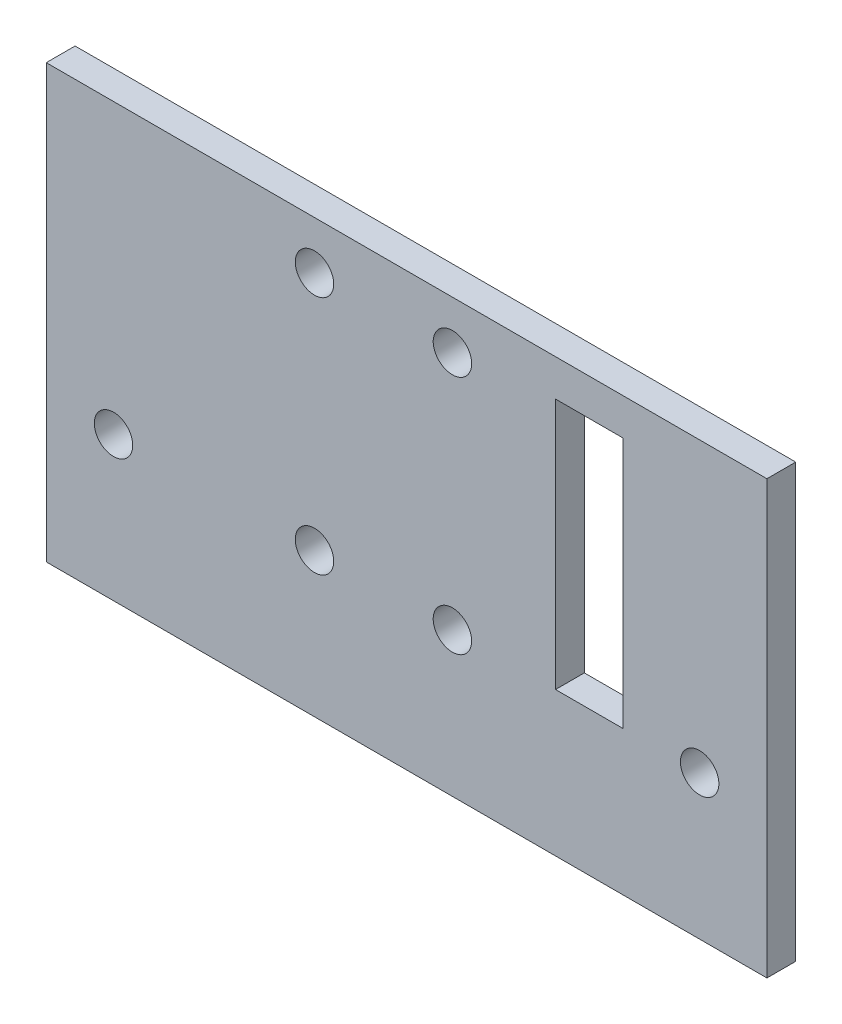
from build123d import *

# Parameters (mm, degrees)
SKETCH1_W           = 75
SKETCH1_H           = 40
SKETCH1_R           = 2
SKETCH1_W_2         = 7
SKETCH1_H_2         = 26.182038529
BOSS_EXTRUDE1_DEPTH = 3
SKETCH2_W           = 75
SKETCH2_H           = 5
BOSS_EXTRUDE2_DEPTH = 3


with BuildPart() as part:
    # Sketch1 → Boss-Extrude1 (new body)
    with BuildSketch(Plane.XY):
        Rectangle(SKETCH1_W, SKETCH1_H)
        with Locations((-30.5, -10)):
            Circle(SKETCH1_R, mode=Mode.SUBTRACT)
        with Locations((30.5, -10)):
            Circle(SKETCH1_R, mode=Mode.SUBTRACT)
        with Locations((4.771003885, 15)):
            Circle(SKETCH1_R, mode=Mode.SUBTRACT)
        with Locations((4.771003885, -10)):
            Circle(SKETCH1_R, mode=Mode.SUBTRACT)
        with Locations((-9.583817368, -10)):
            Circle(SKETCH1_R, mode=Mode.SUBTRACT)
        with Locations((-9.583817368, 15)):
            Circle(SKETCH1_R, mode=Mode.SUBTRACT)
        with Locations((19, 3.091019264)):
            Rectangle(SKETCH1_W_2, SKETCH1_H_2, mode=Mode.SUBTRACT)
    extrude(amount=BOSS_EXTRUDE1_DEPTH)

    # Sketch2 → Boss-Extrude2 (add)
    with BuildSketch(Plane.XY):
        with Locations((0, -22.5)):
            Rectangle(SKETCH2_W, SKETCH2_H)
    extrude(amount=BOSS_EXTRUDE2_DEPTH)


solid = part.part
